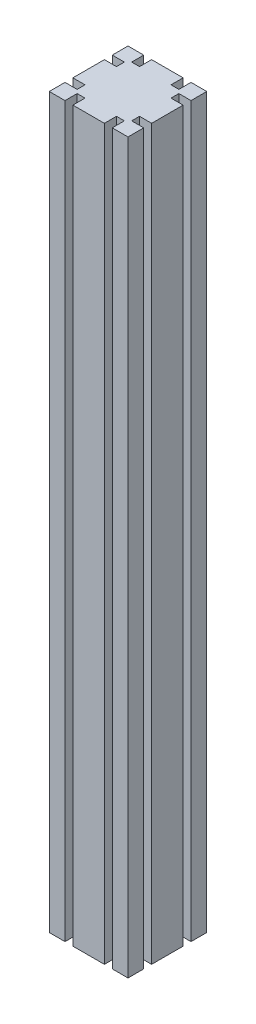
from build123d import *

# Parameters (mm, degrees)
BOSS_EXTRUDE1_DEPTH = 740


with BuildPart() as part:
    # Sketch1 → Boss-Extrude1 (new body)
    with BuildSketch(Plane(origin=(0, 0, 0), x_dir=(1, 0, 0), z_dir=(0, 1, 0))):
        Polygon((-7.320779393, 34.479989845), (-7.320779393, 50.479989845), (8.679220607, 50.479989845), (8.679220607, 38.179989845), (16.679220607, 38.179989845), (16.679220607, 50.479989845), (48.679220607, 50.479989845), (48.679220607, 38.179989845), (56.679220607, 38.179989845), (56.679220607, 50.479989845), (72.679220607, 50.479989845), (72.679220607, 34.479989845), (60.379220607, 34.479989845), (60.379220607, 26.479989845), (72.679220607, 26.479989845), (72.679220607, -5.520010155), (60.379220607, -5.520010155), (60.379220607, -13.520010155), (72.679220607, -13.520010155), (72.679220607, -29.520010155), (56.679220607, -29.520010155), (56.679220607, -17.220010155), (48.679220607, -17.220010155), (48.679220607, -29.520010155), (16.679220607, -29.520010155), (16.679220607, -17.220010155), (8.679220607, -17.220010155), (8.679220607, -29.520010155), (-7.320779393, -29.520010155), (-7.320779393, -13.520010155), (4.979220607, -13.520010155), (4.979220607, -5.520010155), (-7.320779393, -5.520010155), (-7.320779393, 26.479989845), (4.979220607, 26.479989845), (4.979220607, 34.479989845), align=None)
    extrude(amount=BOSS_EXTRUDE1_DEPTH)


solid = part.part
